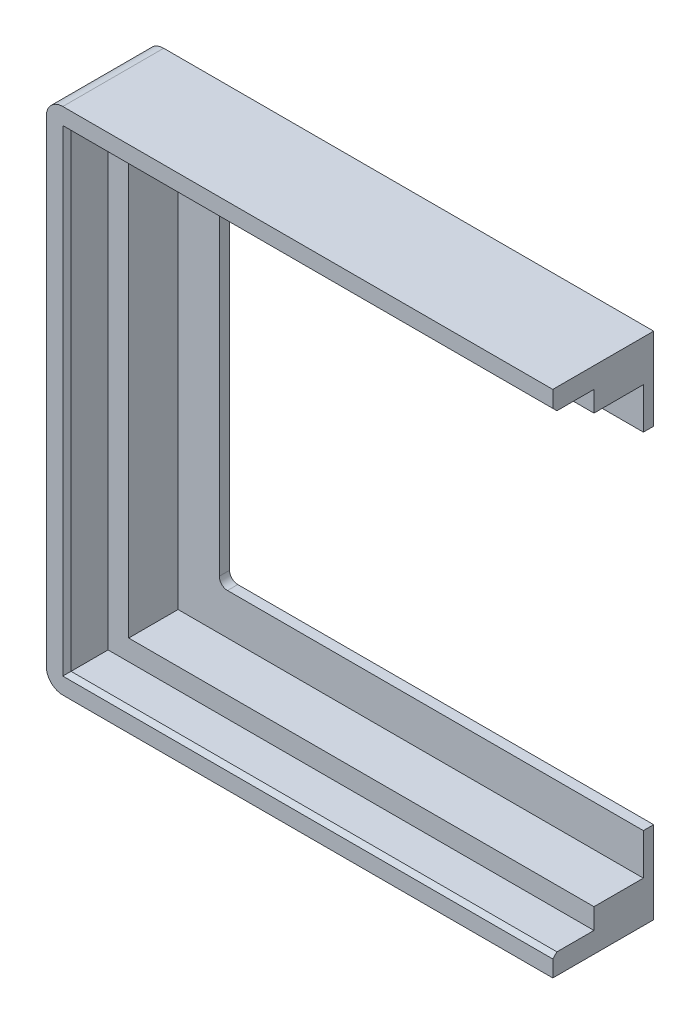
from build123d import *

# Parameters (mm, degrees)
BOSS_EXTRUDE1_DEPTH = 12.7
BOSS_EXTRUDE2_DEPTH = 15.24
BOSS_EXTRUDE3_DEPTH = 3.175
FILLET1_R           = 5.08
FILLET3_R           = 2.54
CHAMFER2_SIZE       = 1.27


with BuildPart() as part:
    # Sketch1 → Boss-Extrude1 (new body)
    with BuildSketch(Plane.XY):
        Polygon((74.93, -72.263), (74.93, -78.613), (-81.28, -78.613), (-81.28, 78.613), (74.93, 78.613), (74.93, 72.263), (-74.93, 72.263), (-74.93, -72.263), align=None)
    extrude(amount=BOSS_EXTRUDE1_DEPTH)

    # Sketch2 → Boss-Extrude2 (add)
    with BuildSketch(Plane(origin=(0, 0, 0), x_dir=(-1, 0, 0), z_dir=(0, 0, -1))):
        Polygon((-74.93, -65.913), (-74.93, -78.613), (81.28, -78.613), (81.28, 78.613), (-74.93, 78.613), (-74.93, 65.913), (68.58, 65.913), (68.58, -65.913), align=None)
    extrude(amount=BOSS_EXTRUDE2_DEPTH)

    # Sketch3 → Boss-Extrude3 (add)
    with BuildSketch(Plane(origin=(0, 0, -15.24), x_dir=(-1, 0, 0), z_dir=(0, 0, -1))):
        Polygon((-74.93, -53.213), (-74.93, -78.613), (81.28, -78.613), (81.28, 78.613), (-74.93, 78.613), (-74.93, 53.213), (55.88, 53.213), (55.88, -53.213), align=None)
    extrude(amount=BOSS_EXTRUDE3_DEPTH)

    # Fillet1
    fillet1_edges = [part.edges().sort_by_distance(p)[0] for p in [
        (-81.28, -78.613, -2.8575),
        (-81.28, 78.613, -2.8575),
    ]]
    fillet(fillet1_edges, radius=FILLET1_R)

    # Fillet3
    fillet3_edges = [part.edges().sort_by_distance(p)[0] for p in [
        (-55.88, 53.213, -16.8275),
        (-55.88, -53.213, -16.8275),
    ]]
    fillet(fillet3_edges, radius=FILLET3_R)

    # Chamfer2
    chamfer2_edges = [part.edges().sort_by_distance(p)[0] for p in [
        (0, -72.263, 12.7),
        (-74.93, 0, 12.7),
        (0, 72.263, 12.7),
    ]]
    chamfer(chamfer2_edges, length=CHAMFER2_SIZE)


solid = part.part
